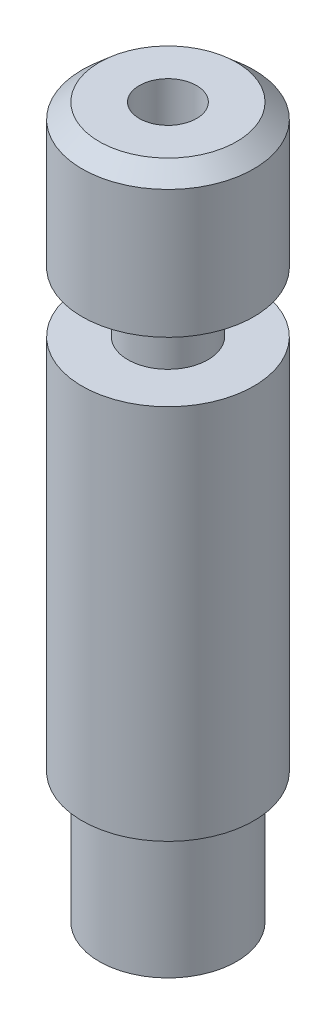
from build123d import *


with BuildPart() as part:
    # Sketch1 → Revolve1 (revolve)
    with BuildSketch(Plane.XY, mode=Mode.PRIVATE) as revolve1_sk:
        Polygon((1.9, 0), (2.4, 0.288675135), (2.4, 4.5), (3, 4.846410162), (3, 18), (1.4, 18), (1.4, 20.1), (3, 20.1), (3, 24.57491445), (2.4, 25.1), (1, 25.1), (1, 0), align=None)
    revolve(revolve1_sk.sketch.rotate(Axis((0, 25.1, 0), (0, -1, 0)), 180), axis=Axis((0, 25.1, 0), (0, -1, 0)))


solid = part.part
